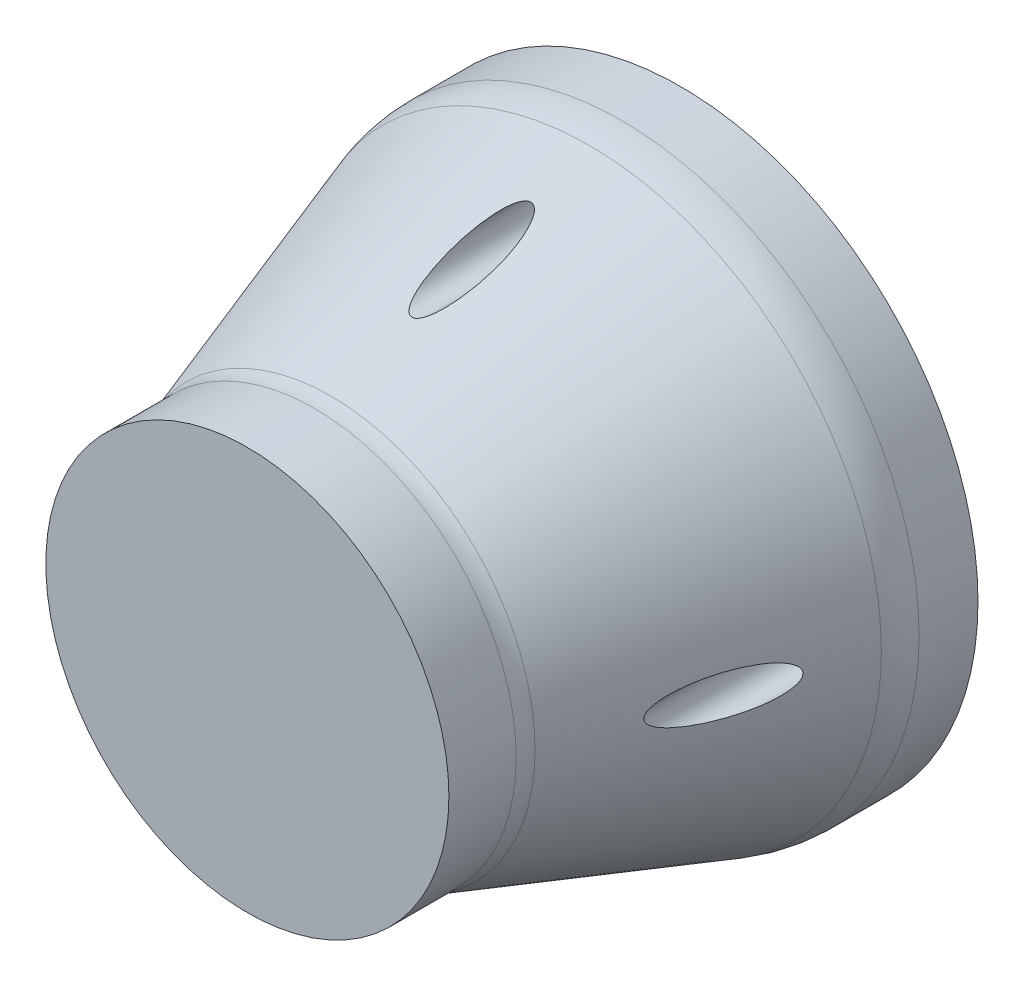
from build123d import *

# Parameters (mm, degrees)
FILLET1_R          = 20
FILLET2_R          = 10
SKETCH2_R          = 4
CUT_EXTRUDE1_DEPTH = 120.824873174


with BuildPart() as part:
    # Sketch1 → Revolve1 (revolve)
    with BuildSketch(Plane(origin=(0, 0, 0), x_dir=(1, 0, 0), z_dir=(0, 1, 0)), mode=Mode.PRIVATE) as revolve1_sk:
        Polygon((0, -43), (-40, -43), (-40, -28), (-59, 28), (-59, 43), (0, 43), align=None)
    revolve(revolve1_sk.sketch.rotate(Axis((0, 0, 171.126428829), (0, 0, -1)), 180), axis=Axis((0, 0, 171.126428829), (0, 0, -1)))

    # Fillet1
    fillet1_edges = [part.edges().sort_by_distance(p)[0] for p in [
        (-59, 0, -28),
    ]]
    fillet(fillet1_edges, radius=FILLET1_R)

    # Fillet2
    fillet2_edges = [part.edges().sort_by_distance(p)[0] for p in [
        (-40, 0, 28),
    ]]
    fillet(fillet2_edges, radius=FILLET2_R)

    # Sketch2 → Cut-Extrude1 (cut, through all)
    with BuildSketch(Plane.XY.offset(43)):
        with Locations((0, 50)):
            Circle(SKETCH2_R)
        with Locations((50, 0)):
            Circle(SKETCH2_R)
        with Locations((0, -50)):
            Circle(SKETCH2_R)
        with Locations((-50, 0)):
            Circle(SKETCH2_R)
    extrude(amount=-CUT_EXTRUDE1_DEPTH, mode=Mode.SUBTRACT)


solid = part.part
